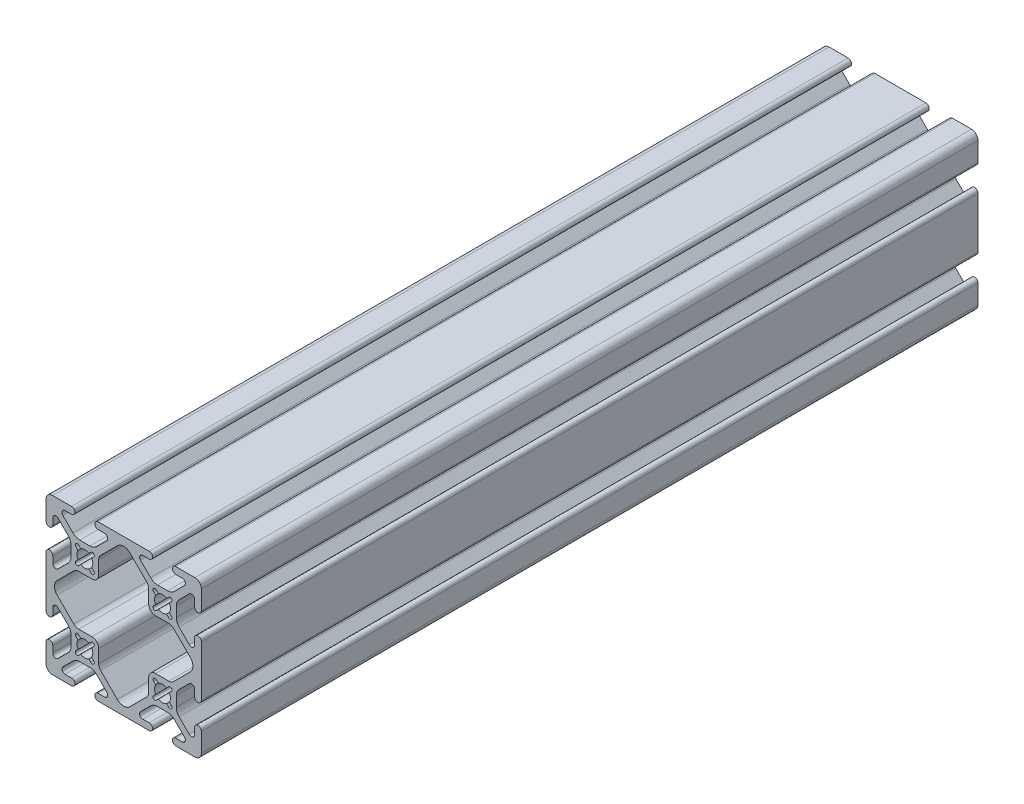
from build123d import *

# Parameters (mm, degrees)
EXTRUDE1_DEPTH = 254


with BuildPart() as part:
    # Sketch1 → Extrude1 (new body)
    with BuildSketch(Plane.XY):
        with BuildLine():
            Line((25.4, 17.0561), (25.4, 23.2918))
            ThreePointArc((25.4, 23.2918), (24.782522516, 24.782522516), (23.2918, 25.4))
            Line((23.2918, 25.4), (17.0561, 25.4))
            ThreePointArc((17.0561, 25.4), (15.9512, 24.2951), (17.0561, 23.1902))
            Line((17.0561, 23.1902), (19.174899798, 23.1902))
            ThreePointArc((19.174899798, 23.1902), (20.113561403, 22.563006367), (19.893320288, 21.45577951))
            Line((19.893320288, 21.45577951), (16.58464389, 18.147103113))
            ThreePointArc((16.58464389, 18.147103113), (15.554599758, 17.458849627), (14.33957986, 17.217167143))
            Line((14.33957986, 17.217167143), (11.06042014, 17.217167143))
            ThreePointArc((11.06042014, 17.217167143), (9.845400242, 17.458849627), (8.81535611, 18.147103113))
            Line((8.81535611, 18.147103113), (5.506679712, 21.45577951))
            ThreePointArc((5.506679712, 21.45577951), (5.286438597, 22.563006367), (6.225100202, 23.1902))
            Line((6.225100202, 23.1902), (8.3439, 23.1902))
            ThreePointArc((8.3439, 23.1902), (9.4488, 24.2951), (8.3439, 25.4))
            Line((8.3439, 25.4), (-8.3439, 25.4))
            ThreePointArc((-8.3439, 25.4), (-9.4488, 24.2951), (-8.3439, 23.1902))
            Line((-8.3439, 23.1902), (-6.225100202, 23.1902))
            ThreePointArc((-6.225100202, 23.1902), (-5.286438597, 22.563006367), (-5.506679712, 21.45577951))
            Line((-5.506679712, 21.45577951), (-8.81535611, 18.147103113))
            ThreePointArc((-8.81535611, 18.147103113), (-9.845400242, 17.458849627), (-11.06042014, 17.217167143))
            Line((-11.06042014, 17.217167143), (-14.33957986, 17.217167143))
            ThreePointArc((-14.33957986, 17.217167143), (-15.554599758, 17.458849627), (-16.58464389, 18.147103113))
            Line((-16.58464389, 18.147103113), (-19.893320288, 21.45577951))
            ThreePointArc((-19.893320288, 21.45577951), (-20.113561403, 22.563006367), (-19.174899798, 23.1902))
            Line((-19.174899798, 23.1902), (-17.0561, 23.1902))
            ThreePointArc((-17.0561, 23.1902), (-15.9512, 24.2951), (-17.0561, 25.4))
            Line((-17.0561, 25.4), (-23.2918, 25.4))
            ThreePointArc((-23.2918, 25.4), (-24.782522516, 24.782522516), (-25.4, 23.2918))
            Line((-25.4, 23.2918), (-25.4, 17.0561))
            ThreePointArc((-25.4, 17.0561), (-24.2951, 15.9512), (-23.1902, 17.0561))
            Line((-23.1902, 17.0561), (-23.1902, 19.174899798))
            ThreePointArc((-23.1902, 19.174899798), (-22.563006367, 20.113561403), (-21.45577951, 19.893320288))
            Line((-21.45577951, 19.893320288), (-18.147103113, 16.58464389))
            ThreePointArc((-18.147103113, 16.58464389), (-17.458849627, 15.554599758), (-17.217167143, 14.33957986))
            Line((-17.217167143, 14.33957986), (-17.217167143, 11.06042014))
            ThreePointArc((-17.217167143, 11.06042014), (-17.458849627, 9.845400242), (-18.147103113, 8.81535611))
            Line((-18.147103113, 8.81535611), (-21.45577951, 5.506679712))
            ThreePointArc((-21.45577951, 5.506679712), (-22.563006367, 5.286438597), (-23.1902, 6.225100202))
            Line((-23.1902, 6.225100202), (-23.1902, 8.3439))
            ThreePointArc((-23.1902, 8.3439), (-24.2951, 9.4488), (-25.4, 8.3439))
            Line((-25.4, 8.3439), (-25.4, -8.3439))
            ThreePointArc((-25.4, -8.3439), (-24.2951, -9.4488), (-23.1902, -8.3439))
            Line((-23.1902, -8.3439), (-23.1902, -6.225100202))
            ThreePointArc((-23.1902, -6.225100202), (-22.563006367, -5.286438597), (-21.45577951, -5.506679712))
            Line((-21.45577951, -5.506679712), (-18.147103113, -8.81535611))
            ThreePointArc((-18.147103113, -8.81535611), (-17.458849627, -9.845400242), (-17.217167143, -11.06042014))
            Line((-17.217167143, -11.06042014), (-17.217167143, -14.33957986))
            ThreePointArc((-17.217167143, -14.33957986), (-17.458849627, -15.554599758), (-18.147103113, -16.58464389))
            Line((-18.147103113, -16.58464389), (-21.45577951, -19.893320288))
            ThreePointArc((-21.45577951, -19.893320288), (-22.563006367, -20.113561403), (-23.1902, -19.174899798))
            Line((-23.1902, -19.174899798), (-23.1902, -17.0561))
            ThreePointArc((-23.1902, -17.0561), (-24.2951, -15.9512), (-25.4, -17.0561))
            Line((-25.4, -17.0561), (-25.4, -23.2918))
            ThreePointArc((-25.4, -23.2918), (-24.782522516, -24.782522516), (-23.2918, -25.4))
            Line((-23.2918, -25.4), (-17.0561, -25.4))
            ThreePointArc((-17.0561, -25.4), (-15.9512, -24.2951), (-17.0561, -23.1902))
            Line((-17.0561, -23.1902), (-19.174899798, -23.1902))
            ThreePointArc((-19.174899798, -23.1902), (-20.113561403, -22.563006367), (-19.893320288, -21.45577951))
            Line((-19.893320288, -21.45577951), (-16.58464389, -18.147103113))
            ThreePointArc((-16.58464389, -18.147103113), (-15.554599758, -17.458849627), (-14.33957986, -17.217167143))
            Line((-14.33957986, -17.217167143), (-11.06042014, -17.217167143))
            ThreePointArc((-11.06042014, -17.217167143), (-9.845400242, -17.458849627), (-8.81535611, -18.147103113))
            Line((-8.81535611, -18.147103113), (-5.506679712, -21.45577951))
            ThreePointArc((-5.506679712, -21.45577951), (-5.286438597, -22.563006367), (-6.225100202, -23.1902))
            Line((-6.225100202, -23.1902), (-8.3439, -23.1902))
            ThreePointArc((-8.3439, -23.1902), (-9.4488, -24.2951), (-8.3439, -25.4))
            Line((-8.3439, -25.4), (8.3439, -25.4))
            ThreePointArc((8.3439, -25.4), (9.4488, -24.2951), (8.3439, -23.1902))
            Line((8.3439, -23.1902), (6.225100202, -23.1902))
            ThreePointArc((6.225100202, -23.1902), (5.286438597, -22.563006367), (5.506679712, -21.45577951))
            Line((5.506679712, -21.45577951), (8.81535611, -18.147103113))
            ThreePointArc((8.81535611, -18.147103113), (9.845400242, -17.458849627), (11.06042014, -17.217167143))
            Line((11.06042014, -17.217167143), (14.33957986, -17.217167143))
            ThreePointArc((14.33957986, -17.217167143), (15.554599758, -17.458849627), (16.58464389, -18.147103113))
            Line((16.58464389, -18.147103113), (19.893320288, -21.45577951))
            ThreePointArc((19.893320288, -21.45577951), (20.113561403, -22.563006367), (19.174899798, -23.1902))
            Line((19.174899798, -23.1902), (17.0561, -23.1902))
            ThreePointArc((17.0561, -23.1902), (15.9512, -24.2951), (17.0561, -25.4))
            Line((17.0561, -25.4), (23.2918, -25.4))
            ThreePointArc((23.2918, -25.4), (24.782522516, -24.782522516), (25.4, -23.2918))
            Line((25.4, -23.2918), (25.4, -17.0561))
            ThreePointArc((25.4, -17.0561), (24.2951, -15.9512), (23.1902, -17.0561))
            Line((23.1902, -17.0561), (23.1902, -19.174899798))
            ThreePointArc((23.1902, -19.174899798), (22.563006367, -20.113561403), (21.45577951, -19.893320288))
            Line((21.45577951, -19.893320288), (18.147103113, -16.58464389))
            ThreePointArc((18.147103113, -16.58464389), (17.458849627, -15.554599758), (17.217167143, -14.33957986))
            Line((17.217167143, -14.33957986), (17.217167143, -11.06042014))
            ThreePointArc((17.217167143, -11.06042014), (17.458849627, -9.845400242), (18.147103113, -8.81535611))
            Line((18.147103113, -8.81535611), (21.45577951, -5.506679712))
            ThreePointArc((21.45577951, -5.506679712), (22.563006367, -5.286438597), (23.1902, -6.225100202))
            Line((23.1902, -6.225100202), (23.1902, -8.3439))
            ThreePointArc((23.1902, -8.3439), (24.2951, -9.4488), (25.4, -8.3439))
            Line((25.4, -8.3439), (25.4, 8.3439))
            ThreePointArc((25.4, 8.3439), (24.2951, 9.4488), (23.1902, 8.3439))
            Line((23.1902, 8.3439), (23.1902, 6.225100202))
            ThreePointArc((23.1902, 6.225100202), (22.563006367, 5.286438597), (21.45577951, 5.506679712))
            Line((21.45577951, 5.506679712), (18.147103113, 8.81535611))
            ThreePointArc((18.147103113, 8.81535611), (17.458849627, 9.845400242), (17.217167143, 11.06042014))
            Line((17.217167143, 11.06042014), (17.217167143, 14.33957986))
            ThreePointArc((17.217167143, 14.33957986), (17.458849627, 15.554599758), (18.147103113, 16.58464389))
            Line((18.147103113, 16.58464389), (21.45577951, 19.893320288))
            ThreePointArc((21.45577951, 19.893320288), (22.563006367, 20.113561403), (23.1902, 19.174899798))
            Line((23.1902, 19.174899798), (23.1902, 17.0561))
            ThreePointArc((23.1902, 17.0561), (24.2951, 15.9512), (25.4, 17.0561))
        make_face()
        with BuildLine():
            Line((-14.669151357, 15.560474191), (-14.040533428, 14.931856263))
            ThreePointArc((-14.040533428, 14.931856263), (-12.7, 15.3035), (-11.359466572, 14.931856263))
            Line((-11.359466572, 14.931856263), (-10.730848643, 15.560474191))
            ThreePointArc((-10.730848643, 15.560474191), (-9.781416761, 15.618583239), (-9.839525809, 14.669151357))
            Line((-9.839525809, 14.669151357), (-10.468143737, 14.040533428))
            ThreePointArc((-10.468143737, 14.040533428), (-10.0965, 12.7), (-10.468143737, 11.359466572))
            Line((-10.468143737, 11.359466572), (-9.839525809, 10.730848643))
            ThreePointArc((-9.839525809, 10.730848643), (-9.781416761, 9.781416761), (-10.730848643, 9.839525809))
            Line((-10.730848643, 9.839525809), (-11.359466572, 10.468143737))
            ThreePointArc((-11.359466572, 10.468143737), (-12.7, 10.0965), (-14.040533428, 10.468143737))
            Line((-14.040533428, 10.468143737), (-14.669151357, 9.839525809))
            ThreePointArc((-14.669151357, 9.839525809), (-15.618583239, 9.781416761), (-15.560474191, 10.730848643))
            Line((-15.560474191, 10.730848643), (-14.931856263, 11.359466572))
            ThreePointArc((-14.931856263, 11.359466572), (-15.3035, 12.7), (-14.931856263, 14.040533428))
            Line((-14.931856263, 14.040533428), (-15.560474191, 14.669151357))
            ThreePointArc((-15.560474191, 14.669151357), (-15.618583239, 15.618583239), (-14.669151357, 15.560474191))
        make_face(mode=Mode.SUBTRACT)
        with BuildLine():
            Line((11.359466572, 10.468143737), (10.730848643, 9.839525809))
            ThreePointArc((10.730848643, 9.839525809), (9.781416761, 9.781416761), (9.839525809, 10.730848643))
            Line((9.839525809, 10.730848643), (10.468143737, 11.359466572))
            ThreePointArc((10.468143737, 11.359466572), (10.0965, 12.7), (10.468143737, 14.040533428))
            Line((10.468143737, 14.040533428), (9.839525809, 14.669151357))
            ThreePointArc((9.839525809, 14.669151357), (9.781416761, 15.618583239), (10.730848643, 15.560474191))
            Line((10.730848643, 15.560474191), (11.359466572, 14.931856263))
            ThreePointArc((11.359466572, 14.931856263), (12.7, 15.3035), (14.040533428, 14.931856263))
            Line((14.040533428, 14.931856263), (14.669151357, 15.560474191))
            ThreePointArc((14.669151357, 15.560474191), (15.618583239, 15.618583239), (15.560474191, 14.669151357))
            Line((15.560474191, 14.669151357), (14.931856263, 14.040533428))
            ThreePointArc((14.931856263, 14.040533428), (15.3035, 12.7), (14.931856263, 11.359466572))
            Line((14.931856263, 11.359466572), (15.560474191, 10.730848643))
            ThreePointArc((15.560474191, 10.730848643), (15.618583239, 9.781416761), (14.669151357, 9.839525809))
            Line((14.669151357, 9.839525809), (14.040533428, 10.468143737))
            ThreePointArc((14.040533428, 10.468143737), (12.7, 10.0965), (11.359466572, 10.468143737))
        make_face(mode=Mode.SUBTRACT)
        with BuildLine():
            Line((-14.669151357, -9.839525809), (-14.040533428, -10.468143737))
            ThreePointArc((-14.040533428, -10.468143737), (-12.7, -10.0965), (-11.359466572, -10.468143737))
            Line((-11.359466572, -10.468143737), (-10.730848643, -9.839525809))
            ThreePointArc((-10.730848643, -9.839525809), (-9.781416761, -9.781416761), (-9.839525809, -10.730848643))
            Line((-9.839525809, -10.730848643), (-10.468143737, -11.359466572))
            ThreePointArc((-10.468143737, -11.359466572), (-10.0965, -12.7), (-10.468143737, -14.040533428))
            Line((-10.468143737, -14.040533428), (-9.839525809, -14.669151357))
            ThreePointArc((-9.839525809, -14.669151357), (-9.781416761, -15.618583239), (-10.730848643, -15.560474191))
            Line((-10.730848643, -15.560474191), (-11.359466572, -14.931856263))
            ThreePointArc((-11.359466572, -14.931856263), (-12.7, -15.3035), (-14.040533428, -14.931856263))
            Line((-14.040533428, -14.931856263), (-14.669151357, -15.560474191))
            ThreePointArc((-14.669151357, -15.560474191), (-15.618583239, -15.618583239), (-15.560474191, -14.669151357))
            Line((-15.560474191, -14.669151357), (-14.931856263, -14.040533428))
            ThreePointArc((-14.931856263, -14.040533428), (-15.3035, -12.7), (-14.931856263, -11.359466572))
            Line((-14.931856263, -11.359466572), (-15.560474191, -10.730848643))
            ThreePointArc((-15.560474191, -10.730848643), (-15.618583239, -9.781416761), (-14.669151357, -9.839525809))
        make_face(mode=Mode.SUBTRACT)
        with BuildLine():
            Line((10.730848643, -9.839525809), (11.359466572, -10.468143737))
            ThreePointArc((11.359466572, -10.468143737), (12.7, -10.0965), (14.040533428, -10.468143737))
            Line((14.040533428, -10.468143737), (14.669151357, -9.839525809))
            ThreePointArc((14.669151357, -9.839525809), (15.618583239, -9.781416761), (15.560474191, -10.730848643))
            Line((15.560474191, -10.730848643), (14.931856263, -11.359466572))
            ThreePointArc((14.931856263, -11.359466572), (15.3035, -12.7), (14.931856263, -14.040533428))
            Line((14.931856263, -14.040533428), (15.560474191, -14.669151357))
            ThreePointArc((15.560474191, -14.669151357), (15.618583239, -15.618583239), (14.669151357, -15.560474191))
            Line((14.669151357, -15.560474191), (14.040533428, -14.931856263))
            ThreePointArc((14.040533428, -14.931856263), (12.7, -15.3035), (11.359466572, -14.931856263))
            Line((11.359466572, -14.931856263), (10.730848643, -15.560474191))
            ThreePointArc((10.730848643, -15.560474191), (9.781416761, -15.618583239), (9.839525809, -14.669151357))
            Line((9.839525809, -14.669151357), (10.468143737, -14.040533428))
            ThreePointArc((10.468143737, -14.040533428), (10.0965, -12.7), (10.468143737, -11.359466572))
            Line((10.468143737, -11.359466572), (9.839525809, -10.730848643))
            ThreePointArc((9.839525809, -10.730848643), (9.781416761, -9.781416761), (10.730848643, -9.839525809))
        make_face(mode=Mode.SUBTRACT)
        with BuildLine():
            Line((7.535597422, -16.30173267), (2.058651438, -21.778678654))
            ThreePointArc((2.058651438, -21.778678654), (0, -22.6314), (-2.058651438, -21.778678654))
            Line((-2.058651438, -21.778678654), (-7.535597422, -16.30173267))
            ThreePointArc((-7.535597422, -16.30173267), (-8.014621848, -15.584821954), (-8.182832857, -14.739168105))
            Line((-8.182832857, -14.739168105), (-8.182832857, -10.392632857))
            ThreePointArc((-8.182832857, -10.392632857), (-8.830068292, -8.830068292), (-10.392632857, -8.182832857))
            Line((-10.392632857, -8.182832857), (-14.739168105, -8.182832857))
            ThreePointArc((-14.739168105, -8.182832857), (-15.584821954, -8.014621848), (-16.30173267, -7.535597422))
            Line((-16.30173267, -7.535597422), (-21.778678654, -2.058651438))
            ThreePointArc((-21.778678654, -2.058651438), (-22.6314, 0), (-21.778678654, 2.058651438))
            Line((-21.778678654, 2.058651438), (-16.30173267, 7.535597422))
            ThreePointArc((-16.30173267, 7.535597422), (-15.584821954, 8.014621848), (-14.739168105, 8.182832857))
            Line((-14.739168105, 8.182832857), (-10.392632857, 8.182832857))
            ThreePointArc((-10.392632857, 8.182832857), (-8.830068292, 8.830068292), (-8.182832857, 10.392632857))
            Line((-8.182832857, 10.392632857), (-8.182832857, 14.739168105))
            ThreePointArc((-8.182832857, 14.739168105), (-8.014621848, 15.584821954), (-7.535597422, 16.30173267))
            Line((-7.535597422, 16.30173267), (-2.058651438, 21.778678654))
            ThreePointArc((-2.058651438, 21.778678654), (0, 22.6314), (2.058651438, 21.778678654))
            Line((2.058651438, 21.778678654), (7.535597422, 16.30173267))
            ThreePointArc((7.535597422, 16.30173267), (8.014621848, 15.584821954), (8.182832857, 14.739168105))
            Line((8.182832857, 14.739168105), (8.182832857, 10.392632857))
            ThreePointArc((8.182832857, 10.392632857), (8.830068292, 8.830068292), (10.392632857, 8.182832857))
            Line((10.392632857, 8.182832857), (14.739168105, 8.182832857))
            ThreePointArc((14.739168105, 8.182832857), (15.584821954, 8.014621848), (16.30173267, 7.535597422))
            Line((16.30173267, 7.535597422), (21.778678654, 2.058651438))
            ThreePointArc((21.778678654, 2.058651438), (22.6314, 0), (21.778678654, -2.058651438))
            Line((21.778678654, -2.058651438), (16.30173267, -7.535597422))
            ThreePointArc((16.30173267, -7.535597422), (15.584821954, -8.014621848), (14.739168105, -8.182832857))
            Line((14.739168105, -8.182832857), (10.392632857, -8.182832857))
            ThreePointArc((10.392632857, -8.182832857), (8.830068292, -8.830068292), (8.182832857, -10.392632857))
            Line((8.182832857, -10.392632857), (8.182832857, -14.739168105))
            ThreePointArc((8.182832857, -14.739168105), (8.014621848, -15.584821954), (7.535597422, -16.30173267))
        make_face(mode=Mode.SUBTRACT)
    extrude(amount=-EXTRUDE1_DEPTH)


solid = part.part
